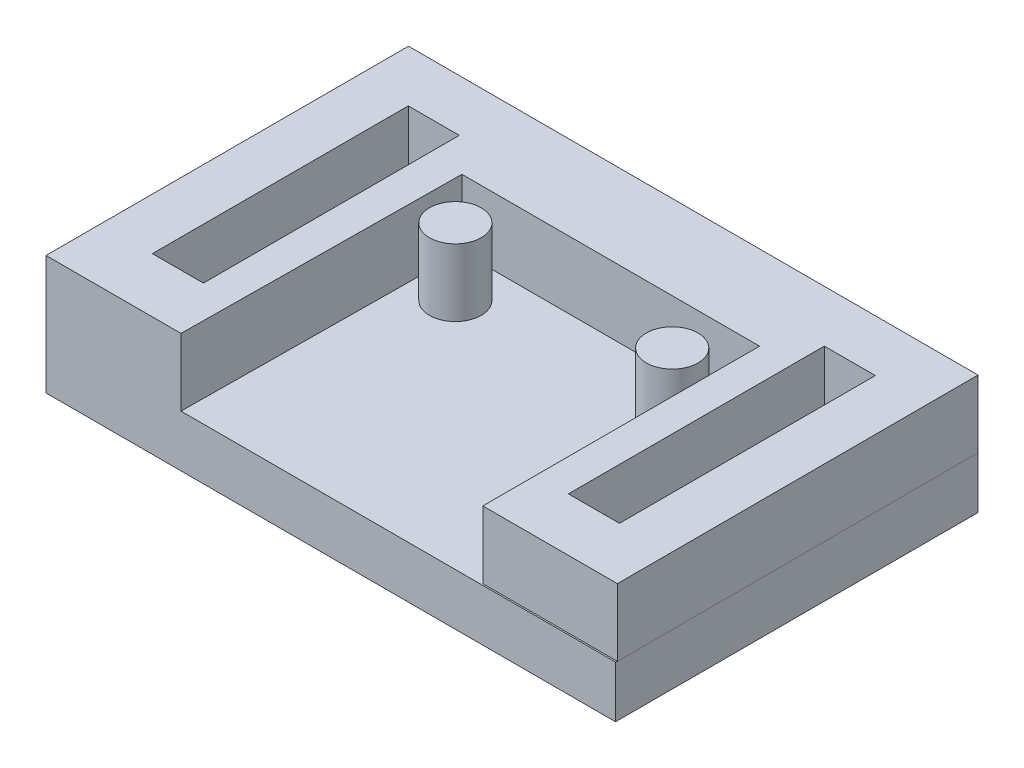
from build123d import *

# Parameters (mm, degrees)
SKETCH1_W           = 27.94
SKETCH1_H           = 17.78
SKETCH1_W_2         = 2.54
SKETCH1_H_2         = 12.7
BOSS_EXTRUDE2_DEPTH = 2.54
SKETCH3_R           = 1.27
BOSS_EXTRUDE3_DEPTH = 3.302
SKETCH6_W           = 2.503557337
SKETCH6_H           = 12.554229347
BOSS_EXTRUDE6_DEPTH = 3.302


with BuildPart() as part:
    # Sketch1 → Boss-Extrude2 (new body)
    with BuildSketch(Plane(origin=(0, 0, 0), x_dir=(1, 0, 0), z_dir=(0, 1, 0))):
        Rectangle(SKETCH1_W, SKETCH1_H)
        with Locations((-10.20489899, 0)):
            Rectangle(SKETCH1_W_2, SKETCH1_H_2, mode=Mode.SUBTRACT)
        with Locations((10.20489899, 0)):
            Rectangle(SKETCH1_W_2, SKETCH1_H_2, mode=Mode.SUBTRACT)
    extrude(amount=BOSS_EXTRUDE2_DEPTH)

    # Sketch3 → Boss-Extrude3 (add)
    with BuildSketch(Plane(origin=(0, 2.54, 0), x_dir=(1, 0, 0), z_dir=(0, 1, 0))):
        with Locations(Location((-5.318941048, 2.54, 0), (0, 0, 90))):
            Circle(SKETCH3_R)
        with Locations(Location((5.318941048, 2.54, 0), (0, 0, 90))):
            Circle(SKETCH3_R)
    extrude(amount=BOSS_EXTRUDE3_DEPTH)

    # Sketch6 → Boss-Extrude6 (add)
    with BuildSketch(Plane(origin=(0, 2.54, 0), x_dir=(1, 0, 0), z_dir=(0, 1, 0))):
        Polygon((-7.215647318, 4.760339872), (7.384221332, 4.760339872), (7.384221332, -8.817114674), (13.988221332, -8.817114674), (13.97, 8.89), (-13.97, 8.89), (-13.97, -8.89), (-7.347778668, -8.89), align=None)
        with Locations((10.223120322, 0.072885327)):
            Rectangle(SKETCH6_W, SKETCH6_H, mode=Mode.SUBTRACT)
        with Locations((-10.186677659, 0.072885327)):
            Rectangle(SKETCH6_W, SKETCH6_H, mode=Mode.SUBTRACT)
    extrude(amount=BOSS_EXTRUDE6_DEPTH)


solid = part.part
